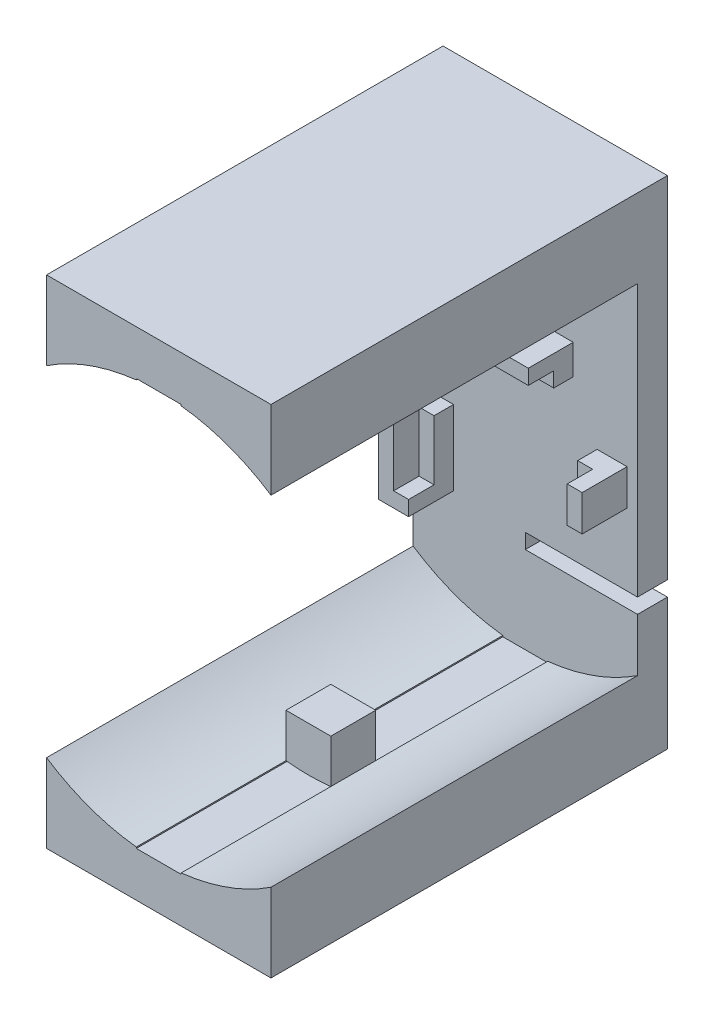
from build123d import *

# Parameters (mm, degrees)
BOSS_EXTRUDE1_DEPTH   = 14.5
BOSS_EXTRUDE1_2_DEPTH = 14.5
BOSS_EXTRUDE1_3_DEPTH = 14.5
BOSS_EXTRUDE1_4_DEPTH = 14.5
SKETCH1_3_W           = 15
SKETCH1_3_H           = 33.2
BOSS_EXTRUDE3_DEPTH   = 2
CUT_EXTRUDE1_DEPTH    = 11.5
BOSS_EXTRUDE4_DEPTH   = 24.5
SKETCH2_W             = 1
SKETCH2_H             = 4
SKETCH2_W_2           = 6.4
SKETCH2_H_2           = 1
SKETCH2_H_3           = 2.4
BOSS_EXTRUDE5_DEPTH   = 1.3
SKETCH2_3_W           = 6.4
SKETCH2_3_H           = 1
SKETCH2_3_W_2         = 1
SKETCH2_3_H_2         = 2.4
BOSS_EXTRUDE6_DEPTH   = 3
SKETCH2_4_W           = 7.5
SKETCH2_4_H           = 1
CUT_EXTRUDE2_DEPTH    = 31.529657712


with BuildPart() as part:
    # Sketch1 → Boss-Extrude1 (new body)
    with BuildSketch(Plane.XY):
        with BuildLine():
            Line((7.5, 16.6), (-7.5, 16.6))
            Line((-7.5, 16.6), (-7.5, 11.34504297))
            ThreePointArc((-7.5, 11.34504297), (-4.629187607, 12.787909215), (-1.5, 13.5170263))
            Line((-1.5, 13.5170263), (-1.5, 13.6))
            Line((-1.5, 13.6), (0, 13.6))
            Line((0, 13.6), (1.5, 13.6))
            Line((1.5, 13.6), (1.5, 13.5170263))
            ThreePointArc((1.5, 13.5170263), (4.629187607, 12.787909215), (7.5, 11.34504297))
            Line((7.5, 11.34504297), (7.5, 16.6))
        make_face()
    extrude(amount=BOSS_EXTRUDE1_DEPTH)



with BuildPart() as body_2:
    # Sketch1 → Boss-Extrude1 2 (new body)
    with BuildSketch(Plane.XY):
        with BuildLine():
            ThreePointArc((0, 13.6), (-0.751146563, 13.579240731), (-1.5, 13.5170263))
            Line((-1.5, 13.5170263), (-1.5, 10.6))
            Line((-1.5, 10.6), (1.5, 10.6))
            Line((1.5, 10.6), (1.5, 13.5170263))
            ThreePointArc((1.5, 13.5170263), (0.751146563, 13.579240731), (0, 13.6))
        make_face()
    extrude(amount=BOSS_EXTRUDE1_2_DEPTH)


with BuildPart() as body_3:
    # Sketch1 → Boss-Extrude1 3 (new body)
    with BuildSketch(Plane.XY):
        with BuildLine():
            Line((-1.5, -10.6), (-1.5, -13.5170263))
            ThreePointArc((-1.5, -13.5170263), (-0.751146563, -13.579240731), (0, -13.6))
            ThreePointArc((0, -13.6), (0.751146563, -13.579240731), (1.5, -13.5170263))
            Line((1.5, -13.5170263), (1.5, -10.6))
            Line((1.5, -10.6), (-1.5, -10.6))
        make_face()
    extrude(amount=BOSS_EXTRUDE1_3_DEPTH)


with BuildPart() as body_4:
    # Sketch1 → Boss-Extrude1 4 (new body)
    with BuildSketch(Plane.XY):
        with BuildLine():
            ThreePointArc((-1.5, -13.5170263), (-4.629187607, -12.787909215), (-7.5, -11.34504297))
            Line((-7.5, -11.34504297), (-7.5, -16.6))
            Line((-7.5, -16.6), (7.5, -16.6))
            Line((7.5, -16.6), (7.5, -11.34504297))
            ThreePointArc((7.5, -11.34504297), (4.629187607, -12.787909215), (1.5, -13.5170263))
            Line((1.5, -13.5170263), (1.5, -13.6))
            Line((1.5, -13.6), (0, -13.6))
            Line((0, -13.6), (-1.5, -13.6))
            Line((-1.5, -13.6), (-1.5, -13.5170263))
        make_face()
    extrude(amount=BOSS_EXTRUDE1_4_DEPTH)


with BuildPart() as part_1:
    add(part.part)

    add(body_4.part)  # Boss-Extrude3 merges body 4
    # Sketch1<3> → Boss-Extrude3 (add)
    with BuildSketch(Plane.XY):
        Rectangle(SKETCH1_3_W, SKETCH1_3_H)
    extrude(amount=-BOSS_EXTRUDE3_DEPTH)

    # Sketch1<5> → Boss-Extrude4 (add)
    with BuildSketch(Plane.XY):
        with BuildLine():
            Line((7.5, 16.6), (-7.5, 16.6))
            Line((-7.5, 16.6), (-7.5, 11.34504297))
            ThreePointArc((-7.5, 11.34504297), (-4.629187607, 12.787909215), (-1.5, 13.5170263))
            Line((-1.5, 13.5170263), (-1.5, 13.6))
            Line((-1.5, 13.6), (0, 13.6))
            Line((0, 13.6), (1.5, 13.6))
            Line((1.5, 13.6), (1.5, 13.5170263))
            ThreePointArc((1.5, 13.5170263), (4.629187607, 12.787909215), (7.5, 11.34504297))
            Line((7.5, 11.34504297), (7.5, 16.6))
        make_face()
        with BuildLine():
            ThreePointArc((-1.5, -13.5170263), (-4.629187607, -12.787909215), (-7.5, -11.34504297))
            Line((-7.5, -11.34504297), (-7.5, -16.6))
            Line((-7.5, -16.6), (7.5, -16.6))
            Line((7.5, -16.6), (7.5, -11.34504297))
            ThreePointArc((7.5, -11.34504297), (4.629187607, -12.787909215), (1.5, -13.5170263))
            Line((1.5, -13.5170263), (1.5, -13.6))
            Line((1.5, -13.6), (0, -13.6))
            Line((0, -13.6), (-1.5, -13.6))
            Line((-1.5, -13.6), (-1.5, -13.5170263))
        make_face()
    extrude(amount=BOSS_EXTRUDE4_DEPTH)

    # Sketch2 → Boss-Extrude5 (add)
    with BuildSketch(Plane.XY):
        with Locations((-5.3, -3.8)):
            Rectangle(SKETCH2_W, SKETCH2_H)
        with Locations((0, 4.3)):
            Rectangle(SKETCH2_W_2, SKETCH2_H_2)
        with Locations((5.3, -0.8)):
            Rectangle(SKETCH2_W, SKETCH2_H_3)
    extrude(amount=BOSS_EXTRUDE5_DEPTH)

    # Sketch2<3> → Boss-Extrude6 (add)
    with BuildSketch(Plane.XY):
        with Locations((0, 5.3)):
            Rectangle(SKETCH2_3_W, SKETCH2_3_H)
        Polygon((-5.8, -1.8), (-6.8, -1.8), (-6.8, -6.8), (-4.8, -6.8), (-4.8, -5.8), (-5.8, -5.8), align=None)
        with Locations((6.3, -0.8)):
            Rectangle(SKETCH2_3_W_2, SKETCH2_3_H_2)
    extrude(amount=BOSS_EXTRUDE6_DEPTH)

    # Sketch2<4> → Cut-Extrude2 (cut, through all)
    with BuildSketch(Plane.XY):
        with Locations((3.75, -7.3)):
            Rectangle(SKETCH2_4_W, SKETCH2_4_H)
    extrude(amount=-CUT_EXTRUDE2_DEPTH, mode=Mode.SUBTRACT)


with BuildPart() as cut_extrude1_tool:
    # Sketch1<4> → Cut-Extrude1 (new body)
    with BuildSketch(Plane.XY):
        with BuildLine():
            Line((-1.5, -10.6), (-1.5, -13.5170263))
            ThreePointArc((-1.5, -13.5170263), (-0.751146563, -13.579240731), (0, -13.6))
            ThreePointArc((0, -13.6), (0.751146563, -13.579240731), (1.5, -13.5170263))
            Line((1.5, -13.5170263), (1.5, -10.6))
            Line((1.5, -10.6), (-1.5, -10.6))
        make_face()
        with BuildLine():
            ThreePointArc((0, 13.6), (-0.751146563, 13.579240731), (-1.5, 13.5170263))
            Line((-1.5, 13.5170263), (-1.5, 10.6))
            Line((-1.5, 10.6), (1.5, 10.6))
            Line((1.5, 10.6), (1.5, 13.5170263))
            ThreePointArc((1.5, 13.5170263), (0.751146563, 13.579240731), (0, 13.6))
        make_face()
    extrude(amount=CUT_EXTRUDE1_DEPTH)


with BuildPart() as body_2_1:
    add(body_2.part)

    # Cut-Extrude1: cut by cut_extrude1_tool
    add(cut_extrude1_tool.part, mode=Mode.SUBTRACT)


with BuildPart() as body_3_1:
    add(body_3.part)

    # Cut-Extrude1: cut by cut_extrude1_tool
    add(cut_extrude1_tool.part, mode=Mode.SUBTRACT)


solid = Compound([part_1.part, body_2_1.part, body_3_1.part])
